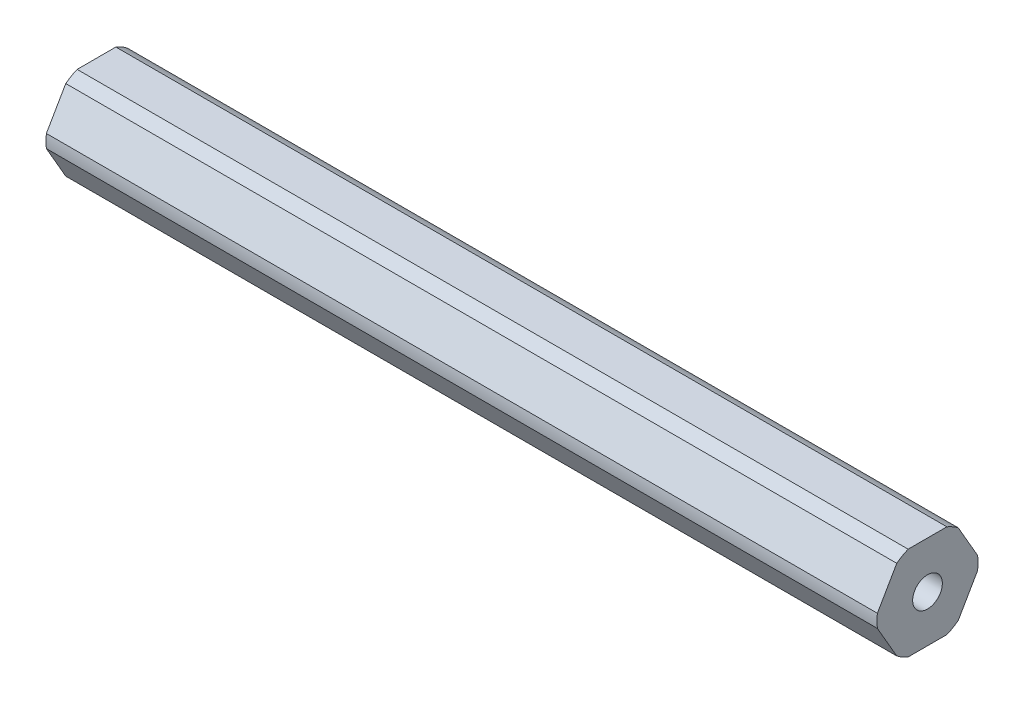
from build123d import *

# Parameters (mm, degrees)
SKETCH1_R           = 2.0193
BOSS_EXTRUDE1_DEPTH = 56.515


with BuildPart() as part:
    # Sketch1 → Boss-Extrude1 (new, symmetric)
    with BuildSketch(Plane(origin=(0, 0, 0), x_dir=(0, 0, -1), z_dir=(1, 0, 0))):
        with BuildLine():
            ThreePointArc((6.874999966, 0), (6.860422465, 0.447468582), (6.816751782, 0.893039571))
            Line((6.816751782, 0.893039571), (4.181770846, 5.456960429))
            ThreePointArc((4.181770846, 5.456960429), (3.437499983, 5.953924622), (2.634980936, 6.35))
            Line((2.634980936, 6.35), (-2.634980936, 6.35))
            ThreePointArc((-2.634980936, 6.35), (-3.437499983, 5.953924622), (-4.181770846, 5.456960429))
            Line((-4.181770846, 5.456960429), (-6.816751782, 0.893039571))
            ThreePointArc((-6.816751782, 0.893039571), (-6.874999966, 0), (-6.816751782, -0.893039571))
            Line((-6.816751782, -0.893039571), (-4.181770846, -5.456960429))
            ThreePointArc((-4.181770846, -5.456960429), (-3.437499983, -5.953924622), (-2.634980936, -6.35))
            Line((-2.634980936, -6.35), (2.634980936, -6.35))
            ThreePointArc((2.634980936, -6.35), (3.437499983, -5.953924622), (4.181770846, -5.456960429))
            Line((4.181770846, -5.456960429), (6.816751782, -0.893039571))
            ThreePointArc((6.816751782, -0.893039571), (6.860422465, -0.447468582), (6.874999966, 0))
        make_face()
        with Locations(Location((0, 0, 0), (0, 0, 180))):
            Circle(SKETCH1_R, mode=Mode.SUBTRACT)
    extrude(amount=BOSS_EXTRUDE1_DEPTH, both=True)


solid = part.part
